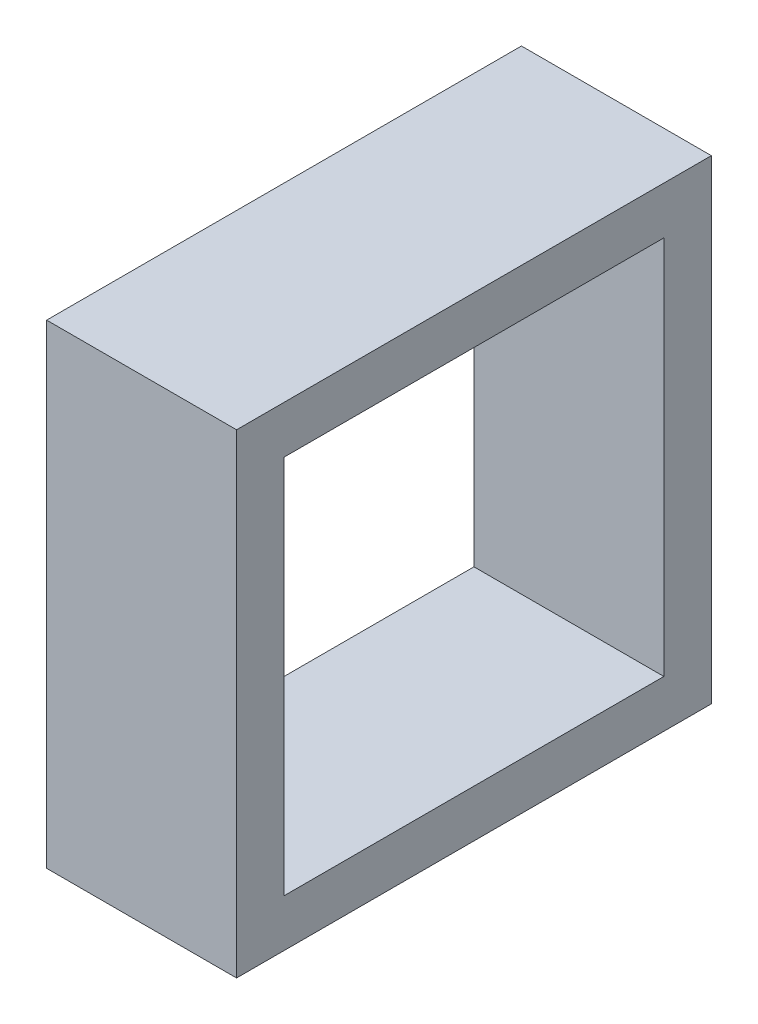
from build123d import *

# Parameters (mm, degrees)
SKETCH_1_W      = 25
SKETCH_1_H      = 25
SKETCH_1_W_2    = 20
SKETCH_1_H_2    = 20
EXTRUDE_1_DEPTH = 10


with BuildPart() as part:
    # 草图1 → 凸台-拉伸1 (new body)
    with BuildSketch(Plane(origin=(0, 0, 0), x_dir=(0, 0, -1), z_dir=(1, 0, 0))):
        Rectangle(SKETCH_1_W, SKETCH_1_H)
        Rectangle(SKETCH_1_W_2, SKETCH_1_H_2, mode=Mode.SUBTRACT)
    extrude(amount=EXTRUDE_1_DEPTH)


solid = part.part
